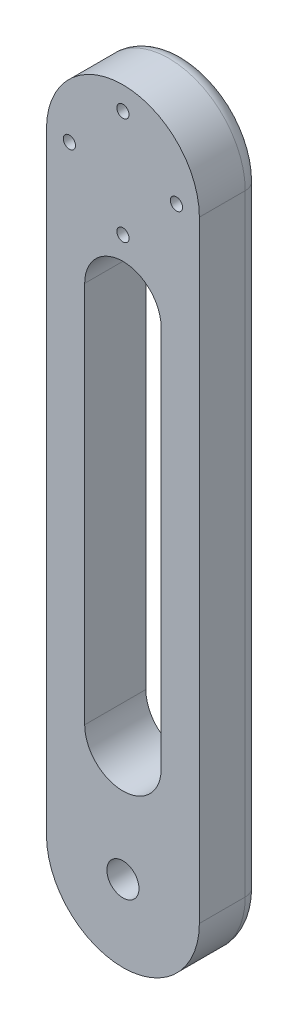
from build123d import *

# Parameters (mm, degrees)
SKETCH1_R           = 10
SKETCH1_R_2         = 0.8
BOSS_EXTRUDE1_DEPTH = 8
FILLET1_R           = 2
CUT_EXTRUDE1_DEPTH  = 60


with BuildPart() as part:
    # Sketch1 → Boss-Extrude1 (new body)
    # profile 1 of 6: a face of its own
    with BuildSketch(Plane.XY):
        with BuildLine():
            ThreePointArc((10, 0), (0, -10), (-10, 0))
            Line((-10, 0), (-10, -80))
            ThreePointArc((-10, -80), (0, -70), (10, -80))
            Line((10, -80), (10, 0))
        make_face()
    # profile 2 of 6: a face of its own
    with BuildSketch(Plane.XY):
        Circle(SKETCH1_R)
        with Locations((-7, 0)):
            Circle(SKETCH1_R_2, mode=Mode.SUBTRACT)
        with Locations((0, -7)):
            Circle(SKETCH1_R_2, mode=Mode.SUBTRACT)
        with Locations((7, 0)):
            Circle(SKETCH1_R_2, mode=Mode.SUBTRACT)
        with Locations((0, 7)):
            Circle(SKETCH1_R_2, mode=Mode.SUBTRACT)
    # profile 3 of 6: a face of its own
    with BuildSketch(Plane.XY):
        with BuildLine():
            ThreePointArc((10, -80), (0, -70), (-10, -80))
            Line((-10, -80), (-2.1, -80))
            ThreePointArc((-2.1, -80), (0, -77.9), (2.1, -80))
            Line((2.1, -80), (10, -80))
        make_face()
    # profile 4 of 6: a face of its own
    with BuildSketch(Plane.XY):
        with BuildLine():
            Line((-2.1, -80), (-10, -80))
            ThreePointArc((-10, -80), (0, -90), (10, -80))
            Line((10, -80), (2.1, -80))
            ThreePointArc((2.1, -80), (0, -82.1), (-2.1, -80))
        make_face()
    # profile 5 of 6: a face of its own
    with BuildSketch(Plane.XY):
        with BuildLine():
            ThreePointArc((10, -80), (0, -70), (-10, -80))
            Line((-10, -80), (-2.1, -80))
            ThreePointArc((-2.1, -80), (0, -77.9), (2.1, -80))
            Line((2.1, -80), (10, -80))
        make_face()
    # profile 6 of 6: a face of its own
    with BuildSketch(Plane.XY):
        with BuildLine():
            Line((-2.1, -80), (-10, -80))
            ThreePointArc((-10, -80), (0, -90), (10, -80))
            Line((10, -80), (2.1, -80))
            ThreePointArc((2.1, -80), (0, -82.1), (-2.1, -80))
        make_face()
    extrude(amount=BOSS_EXTRUDE1_DEPTH)

    # Fillet1
    fillet1_edges = [part.edges().sort_by_distance(p)[0] for p in [
        (-10, -40, 0),
        (0, 10, 0),
        (10, -40, 0),
        (0, -90, 0),
    ]]
    fillet(fillet1_edges, radius=FILLET1_R)

    # Sketch3 → Cut-Extrude1 (cut)
    with BuildSketch(Plane(origin=(0, 0, 0), x_dir=(-1, 0, 0), z_dir=(0, 0, -1))):
        with BuildLine():
            Line((-5, -65), (-5, -15))
            ThreePointArc((-5, -15), (0, -10), (5, -15))
            Line((5, -15), (5, -65))
            ThreePointArc((5, -65), (0, -70), (-5, -65))
        make_face()
    extrude(amount=-CUT_EXTRUDE1_DEPTH, mode=Mode.SUBTRACT)


solid = part.part
